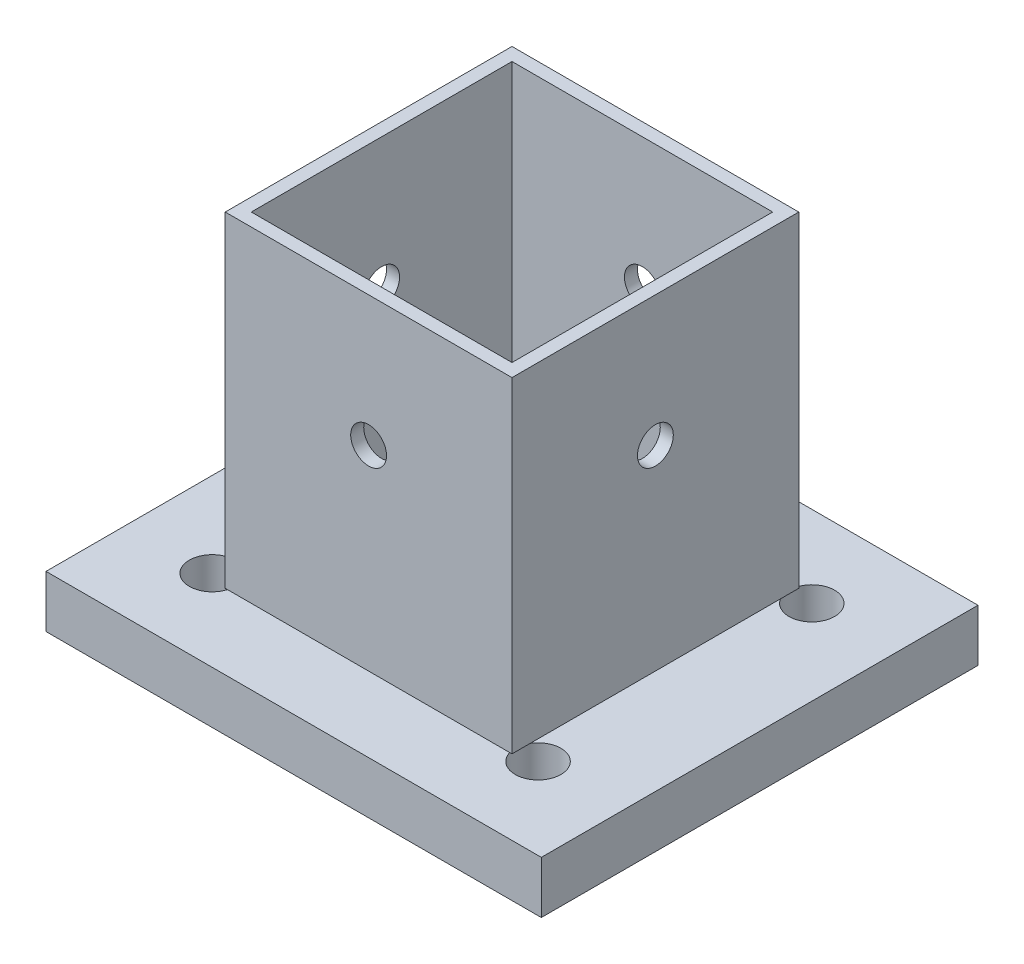
from build123d import *

# Parameters (mm, degrees)
SKETCH_1_W               = 76
SKETCH_1_H               = 67
SKETCH_1_R               = 3.5
EXTRUDE_1_DEPTH          = 8
SKETCH_2_W               = 44
SKETCH_2_H               = 44
SKETCH_2_W_2             = 40
SKETCH_2_H_2             = 40
EXTRUDE_1_2_DEPTH        = 50
CUT_EXTRUDE_1_REACH      = 90.816
SKETCH_3_R               = 2.75
PATTERN_CIRCULAR_1_COUNT = 4


with BuildPart() as part:
    # Эскиз1 → Extrude 1 (new body)
    with BuildSketch(Plane(origin=(0, 0, 0), x_dir=(1, 0, 0), z_dir=(0, 1, 0))):
        Rectangle(SKETCH_1_W, SKETCH_1_H)
        with Locations((-25, 21)):
            Circle(SKETCH_1_R, mode=Mode.SUBTRACT)
        with Locations((25, 21)):
            Circle(SKETCH_1_R, mode=Mode.SUBTRACT)
        with Locations((25, -21)):
            Circle(SKETCH_1_R, mode=Mode.SUBTRACT)
        with Locations((-25, -21)):
            Circle(SKETCH_1_R, mode=Mode.SUBTRACT)
    extrude(amount=EXTRUDE_1_DEPTH)

    # Эскиз2 → Extrude 1 2 (add)
    with BuildSketch(Plane(origin=(0, 8, 0), x_dir=(1, 0, 0), z_dir=(0, 1, 0))):
        Rectangle(SKETCH_2_W, SKETCH_2_H)
        Rectangle(SKETCH_2_W_2, SKETCH_2_H_2, mode=Mode.SUBTRACT)
    extrude(amount=EXTRUDE_1_2_DEPTH)

    # Эскиз3 → Вырез-Вытянуть1 (cut, up to next)
    with BuildSketch(Plane.XY.offset(22), mode=Mode.PRIVATE) as cut_extrude_1_sk1:
        with Locations((0, 38)):
            Circle(SKETCH_3_R)
    cut_extrude_1_tool1 = extrude(cut_extrude_1_sk1.sketch, amount=-CUT_EXTRUDE_1_REACH, mode=Mode.PRIVATE) & part.part
    cut_extrude_1 = cut_extrude_1_tool1.solids().sort_by_distance((0, 38, 22))[0]
    add(cut_extrude_1, mode=Mode.SUBTRACT)

    # Круговой массив1: Вырез-Вытянуть1 ×4 about axis
    pattern_circular_1_axis = Axis((0, 55, 0), (0, -1, 0))
    for i in range(1, PATTERN_CIRCULAR_1_COUNT):
        add(cut_extrude_1.rotate(pattern_circular_1_axis, i * 360 / PATTERN_CIRCULAR_1_COUNT), mode=Mode.SUBTRACT)


solid = part.part
